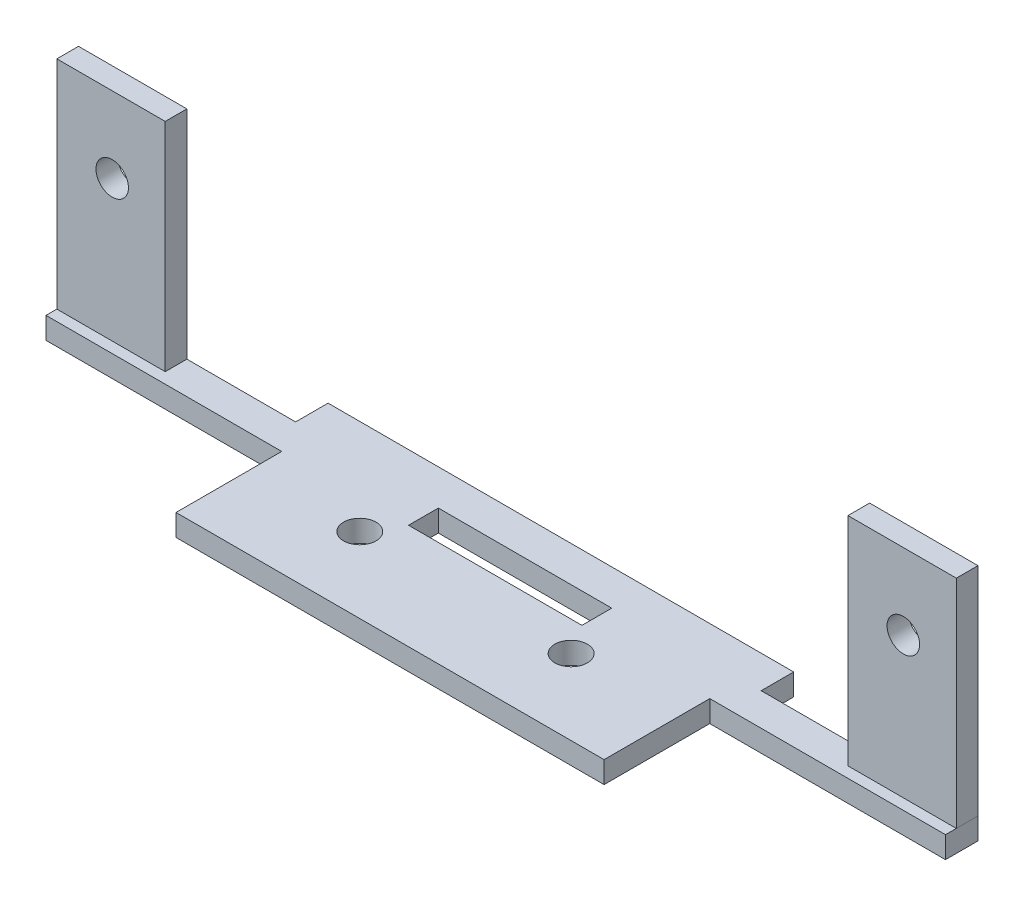
from build123d import *

# Parameters (mm, degrees)
SKETCH2_W                = 10
SKETCH2_H                = 20
BOSS_EXTRUDE1_DEPTH      = 2
BOSS_EXTRUDE1_2_DEPTH    = 2
SKETCH6_R                = 1.5
CUT_EXTRUDE1_DEPTH       = 2
BOSS_EXTRUDE2_DEPTH      = 15
BOSS_EXTRUDE2_DEPTH_BACK = 5
SKETCH7_W                = 82.998753655
SKETCH7_H                = 2
SKETCH8_R                = 1.5
SKETCH8_W                = 16
SKETCH8_H                = 2.75
CUT_EXTRUDE2_DEPTH       = 15
SKETCH9_W                = 20.030400643
SKETCH9_H                = 3
SKETCH9_W_2              = 20.007179251
CUT_EXTRUDE3_DEPTH       = 15


with BuildPart() as part:
    # Sketch2 → Boss-Extrude1 (new body)
    with BuildSketch(Plane.XY):
        with Locations((7.834645669, 10)):
            Rectangle(SKETCH2_W, SKETCH2_H)
    extrude(amount=BOSS_EXTRUDE1_DEPTH)


with BuildPart() as body_2:
    # Sketch2 → Boss-Extrude1 2 (new body)
    with BuildSketch(Plane.XY):
        with Locations((80.834645669, 10)):
            Rectangle(SKETCH2_W, SKETCH2_H)
    extrude(amount=BOSS_EXTRUDE1_2_DEPTH)


with BuildPart() as cut_extrude1_tool:
    # Sketch6 → Cut-Extrude1 (new body)
    with BuildSketch(Plane(origin=(0, 0, 0), x_dir=(-1, 0, 0), z_dir=(0, 0, -1))):
        with Locations((-80.943458849, 13)):
            Circle(SKETCH6_R)
        with Locations((-7.943458849, 13)):
            Circle(SKETCH6_R)
    extrude(amount=-CUT_EXTRUDE1_DEPTH)


with BuildPart() as part_1:
    add(part.part)

    # Cut-Extrude1: cut by cut_extrude1_tool
    add(cut_extrude1_tool.part, mode=Mode.SUBTRACT)



with BuildPart() as body_2_1:
    add(body_2.part)

    # Cut-Extrude1: cut by cut_extrude1_tool
    add(cut_extrude1_tool.part, mode=Mode.SUBTRACT)


with BuildPart() as part_2:
    add(part_1.part)

    add(body_2_1.part)  # Boss-Extrude2 merges body 2
    # Sketch7 → Boss-Extrude2 (add, two sides: drawn at the far end of the back side and taken through both)
    with BuildSketch(Plane.XY.offset(2).offset(-BOSS_EXTRUDE2_DEPTH_BACK)):
        with Locations((44.334022496, -1)):
            Rectangle(SKETCH7_W, SKETCH7_H)
    extrude(amount=BOSS_EXTRUDE2_DEPTH + BOSS_EXTRUDE2_DEPTH_BACK)

    # Sketch8 → Cut-Extrude2 (cut)
    with BuildSketch(Plane.XZ.offset(2)):
        with Locations(Location((54.084645669, 5.796272293, 0), (0, 0, 270))):
            Circle(SKETCH8_R)
        with Locations(Location((34.584645669, 5.796272293, 0), (0, 0, 270))):
            Circle(SKETCH8_R)
        with Locations((44.334645669, 1.671272293)):
            Rectangle(SKETCH8_W, SKETCH8_H)
        Polygon((24.584645669, 12.752716477), (24.584645669, 3), (2.834645669, 3), (2.834645669, 17), (85.833399324, 17), (85.833399324, 3), (64.084645669, 3), (64.084645669, 12.752716477), align=None)
    extrude(amount=-CUT_EXTRUDE2_DEPTH, mode=Mode.SUBTRACT)

    # Sketch9 → Cut-Extrude3 (cut)
    with BuildSketch(Plane(origin=(0, 0, 0), x_dir=(1, 0, 0), z_dir=(0, 1, 0))):
        with Locations((12.849845991, 1.5)):
            Rectangle(SKETCH9_W, SKETCH9_H)
        with Locations((75.829809699, 1.5)):
            Rectangle(SKETCH9_W_2, SKETCH9_H)
    extrude(amount=-CUT_EXTRUDE3_DEPTH, mode=Mode.SUBTRACT)


solid = part_2.part
